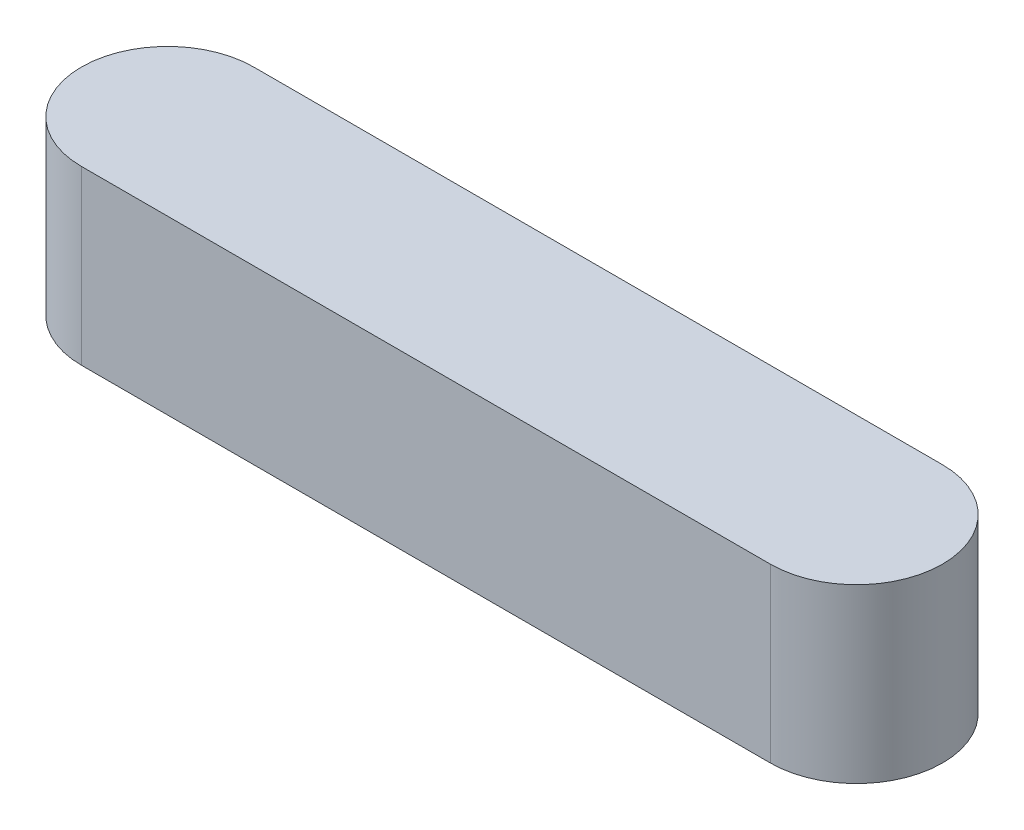
from build123d import *

# Parameters (mm, degrees)
Y_KSEKLIK_EKSTR_ZYON1_DEPTH = 50


with BuildPart() as part:
    # Çizim1 → Yükseklik-Ekstrüzyon1 (new body)
    with BuildSketch(Plane(origin=(0, 0, 0), x_dir=(1, 0, 0), z_dir=(0, 1, 0))):
        with BuildLine():
            Line((-93.380431614, 25), (106.619568386, 25))
            ThreePointArc((106.619568386, 25), (131.619568386, 0), (106.619568386, -25))
            Line((106.619568386, -25), (-93.380431614, -25))
            ThreePointArc((-93.380431614, -25), (-118.380431614, 0), (-93.380431614, 25))
        make_face()
    extrude(amount=Y_KSEKLIK_EKSTR_ZYON1_DEPTH)


solid = part.part
